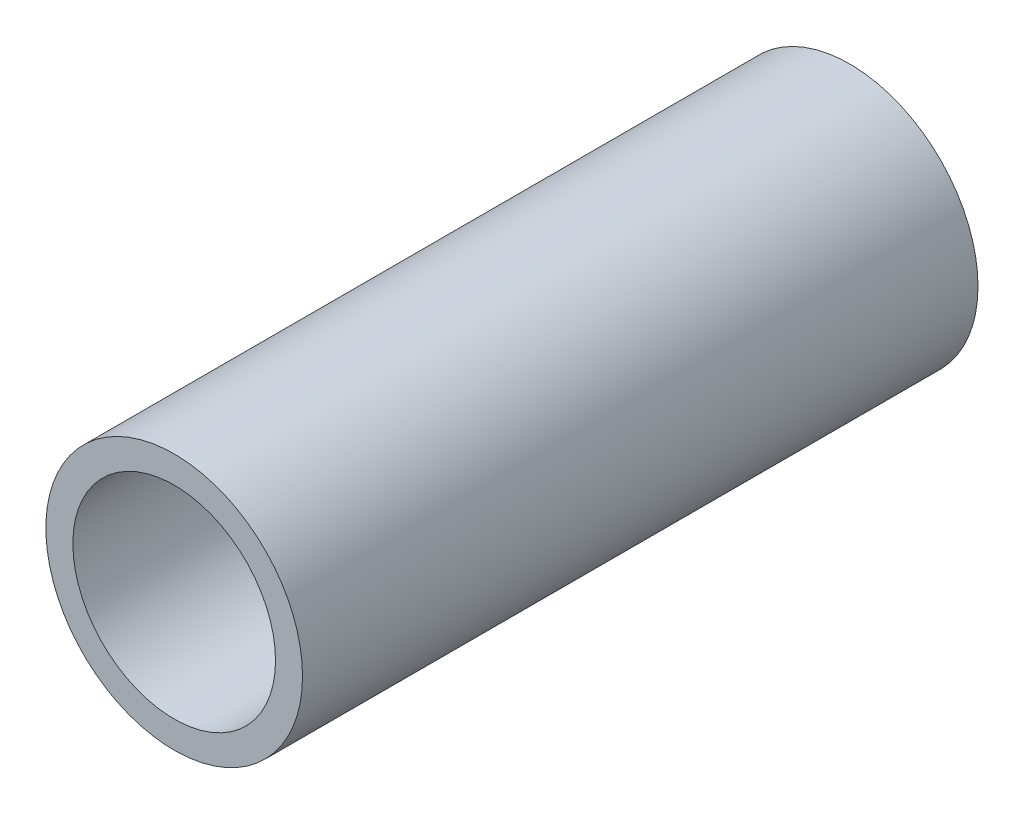
from build123d import *

# Parameters (mm, degrees)
SKETCH1_R           = 9.5
SKETCH1_R_2         = 7.5
EXTRUDE_THIN1_DEPTH = 50


with BuildPart() as part:
    # Sketch1 → Extrude-Thin1 (new body)
    with BuildSketch(Plane.XY):
        with Locations((50, 0)):
            Circle(SKETCH1_R)
        with Locations((50, 0)):
            Circle(SKETCH1_R_2, mode=Mode.SUBTRACT)
    extrude(amount=EXTRUDE_THIN1_DEPTH)


solid = part.part
